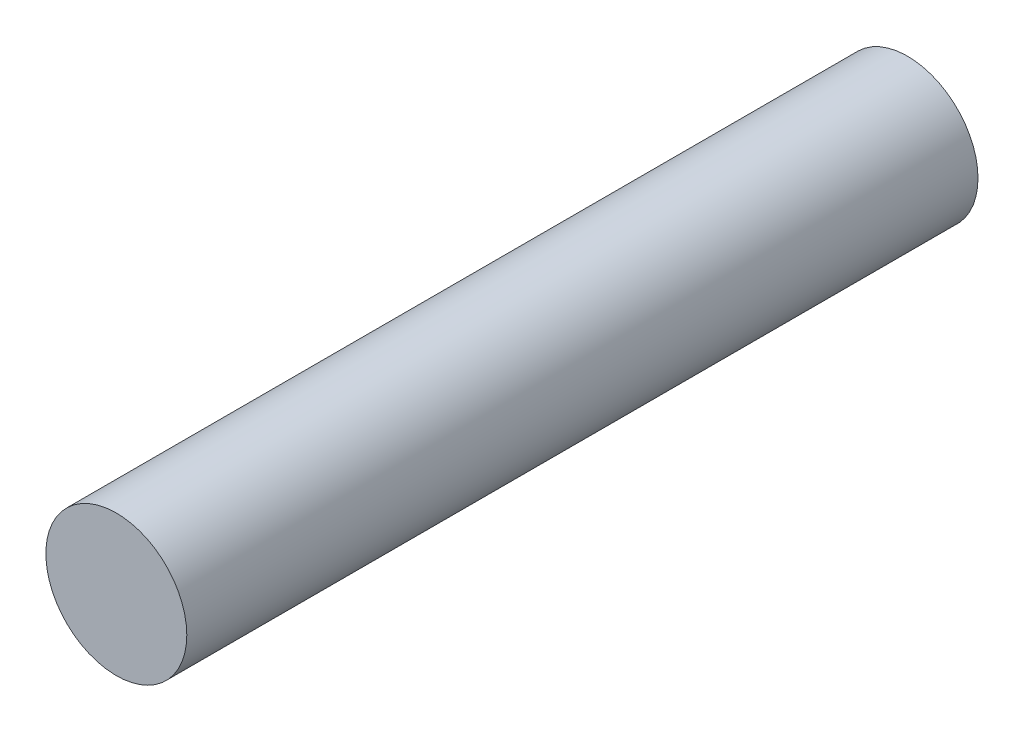
from build123d import *

# Parameters (mm, degrees)
CROQUIS1_R              = 1.75
SALIENTE_EXTRUIR1_DEPTH = 19.65


with BuildPart() as part:
    # Croquis1 → Saliente-Extruir1 (new body)
    with BuildSketch(Plane.XY):
        Circle(CROQUIS1_R)
    extrude(amount=SALIENTE_EXTRUIR1_DEPTH)


solid = part.part
